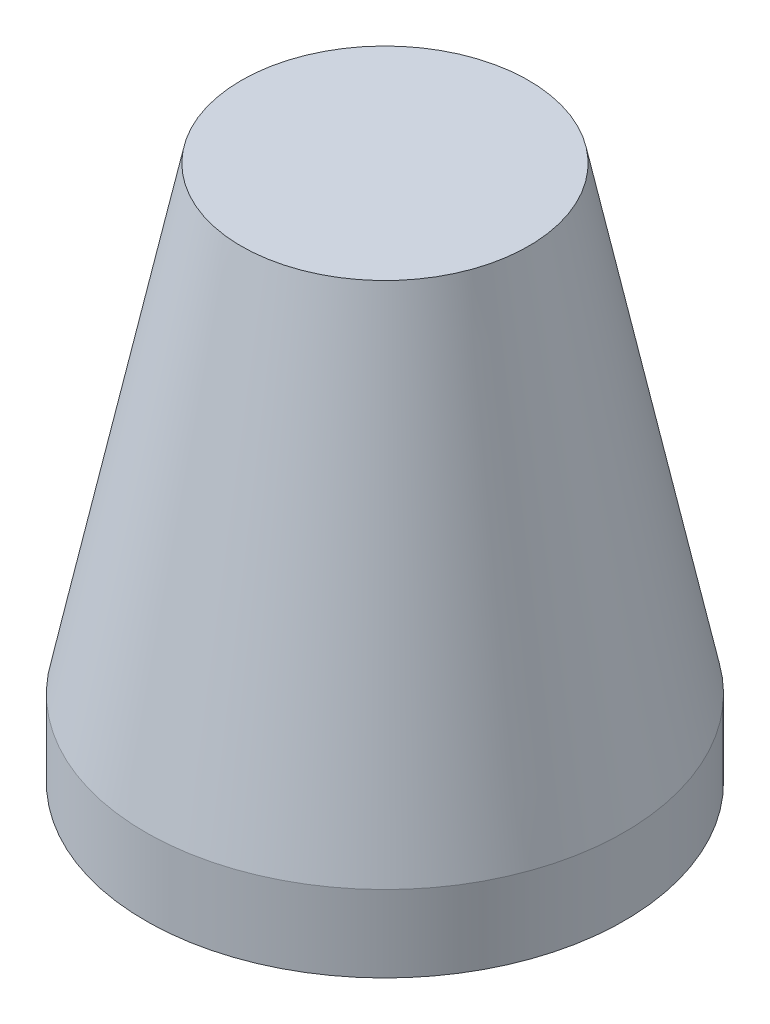
from build123d import *


with BuildPart() as part:
    # 草图1 → 旋转1 (revolve)
    with BuildSketch(Plane.XY):
        Polygon((0, 0), (-25, 0), (-25, 8), (-15, 56), (0, 56), align=None)
    revolve(axis=Axis((0, 56, 0), (0, -1, 0)))


solid = part.part
